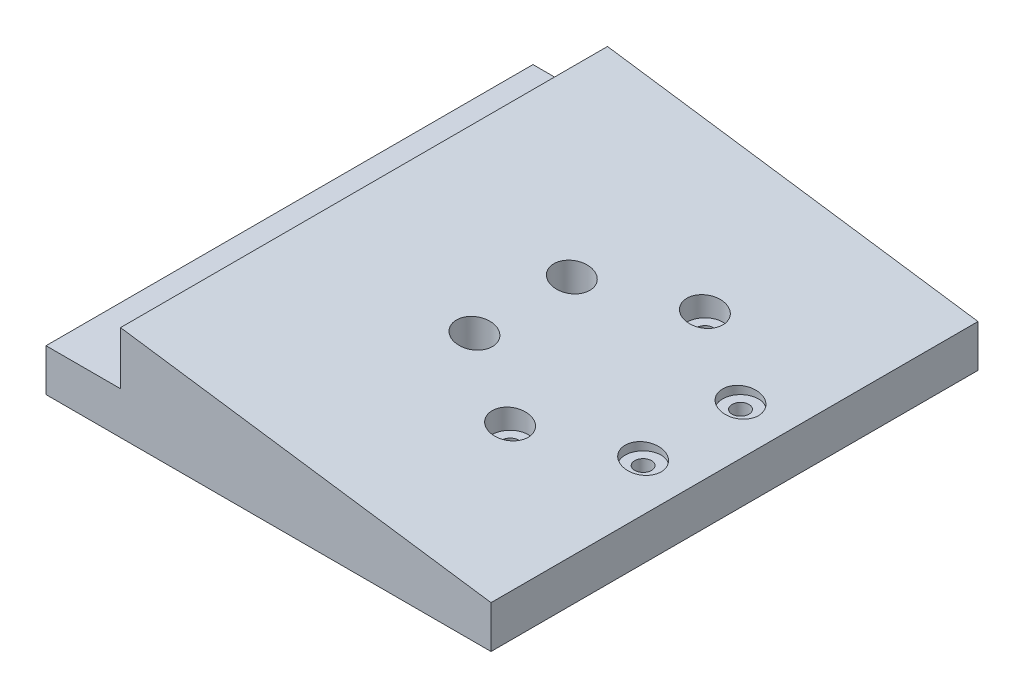
from build123d import *

# Parameters (mm, degrees)
SKETCH1_W           = 105.1
SKETCH1_H           = 115
BOSS_EXTRUDE1_DEPTH = 10
BOSS_EXTRUDE2_DEPTH = 115
SKETCH2_R           = 2
CUT_EXTRUDE1_DEPTH  = 20
SKETCH4_R           = 4.25
CUT_EXTRUDE2_DEPTH  = 40


with BuildPart() as part:
    # Sketch1 → Boss-Extrude1 (new body)
    with BuildSketch(Plane(origin=(0, 0, 0), x_dir=(1, 0, 0), z_dir=(0, 1, 0))):
        Rectangle(SKETCH1_W, SKETCH1_H)
    extrude(amount=BOSS_EXTRUDE1_DEPTH)

    # Sketch3 → Boss-Extrude2 (add)
    with BuildSketch(Plane.XY.offset(57.5)):
        Polygon((-34.95, 10), (52.55, 10), (-34.95, 22.5), align=None)
    extrude(amount=-BOSS_EXTRUDE2_DEPTH)

    # Sketch2 → Cut-Extrude1 (cut)
    with BuildSketch(Plane.XZ):
        with Locations(Location((22.55, 23, 0), (0, 0, 270))):
            Circle(SKETCH2_R)
        with Locations(Location((2.631415713, 11.5, 0), (0, 0, 270))):
            Circle(SKETCH2_R)
        with Locations(Location((2.631415713, -11.5, 0), (0, 0, 270))):
            Circle(SKETCH2_R)
        with Locations(Location((22.55, -23, 0), (0, 0, 270))):
            Circle(SKETCH2_R)
        with Locations(Location((42.468584287, -11.5, 0), (0, 0, 270))):
            Circle(SKETCH2_R)
        with Locations(Location((42.468584287, 11.5, 0), (0, 0, 270))):
            Circle(SKETCH2_R)
    extrude(amount=-CUT_EXTRUDE1_DEPTH, mode=Mode.SUBTRACT)

    # Sketch4 → Cut-Extrude2 (cut)
    with BuildSketch(Plane(origin=(0, 50, 0), x_dir=(-1, 0, 0), z_dir=(0, -1, 0))):
        with Locations((-22.55, 23)):
            Circle(SKETCH4_R)
        with Locations((-2.631415713, 11.5)):
            Circle(SKETCH4_R)
        with Locations((-2.631415713, -11.5)):
            Circle(SKETCH4_R)
        with Locations((-22.55, -23)):
            Circle(SKETCH4_R)
        with Locations((-42.468584287, -11.5)):
            Circle(SKETCH4_R)
        with Locations((-42.468584287, 11.5)):
            Circle(SKETCH4_R)
    extrude(amount=CUT_EXTRUDE2_DEPTH, mode=Mode.SUBTRACT)


solid = part.part
